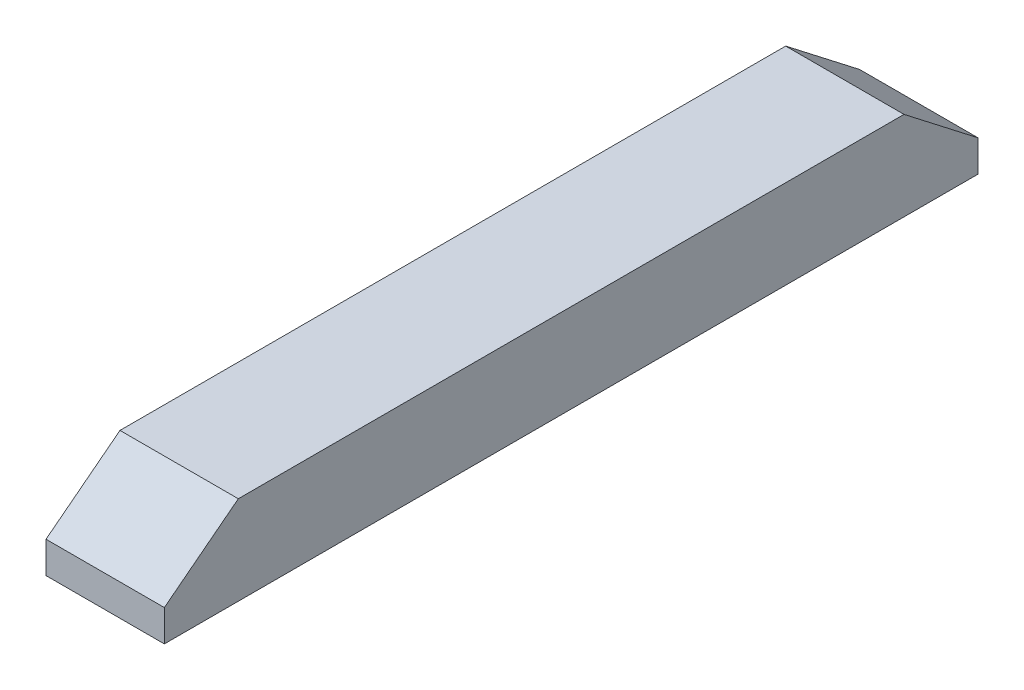
from build123d import *

# Parameters (mm, degrees)
SKETCH2_W           = 80
SKETCH2_H           = 60
BOSS_EXTRUDE1_DEPTH = 550
CUT_EXTRUDE3_DEPTH  = 80


with BuildPart() as part:
    # Sketch2 → Boss-Extrude1 (new body)
    with BuildSketch(Plane.XY):
        Rectangle(SKETCH2_W, SKETCH2_H)
    extrude(amount=BOSS_EXTRUDE1_DEPTH)

    # Sketch4 → Cut-Extrude3 (cut)
    with BuildSketch(Plane(origin=(40, 0, 0), x_dir=(0, 0, -1), z_dir=(1, 0, 0))):
        Polygon((-550, 30), (-550, -8.699429877), (-500, 30), align=None)
        Polygon((-50, 30), (0, -8.699429877), (0, 30), align=None)
    extrude(amount=-CUT_EXTRUDE3_DEPTH, mode=Mode.SUBTRACT)


solid = part.part
